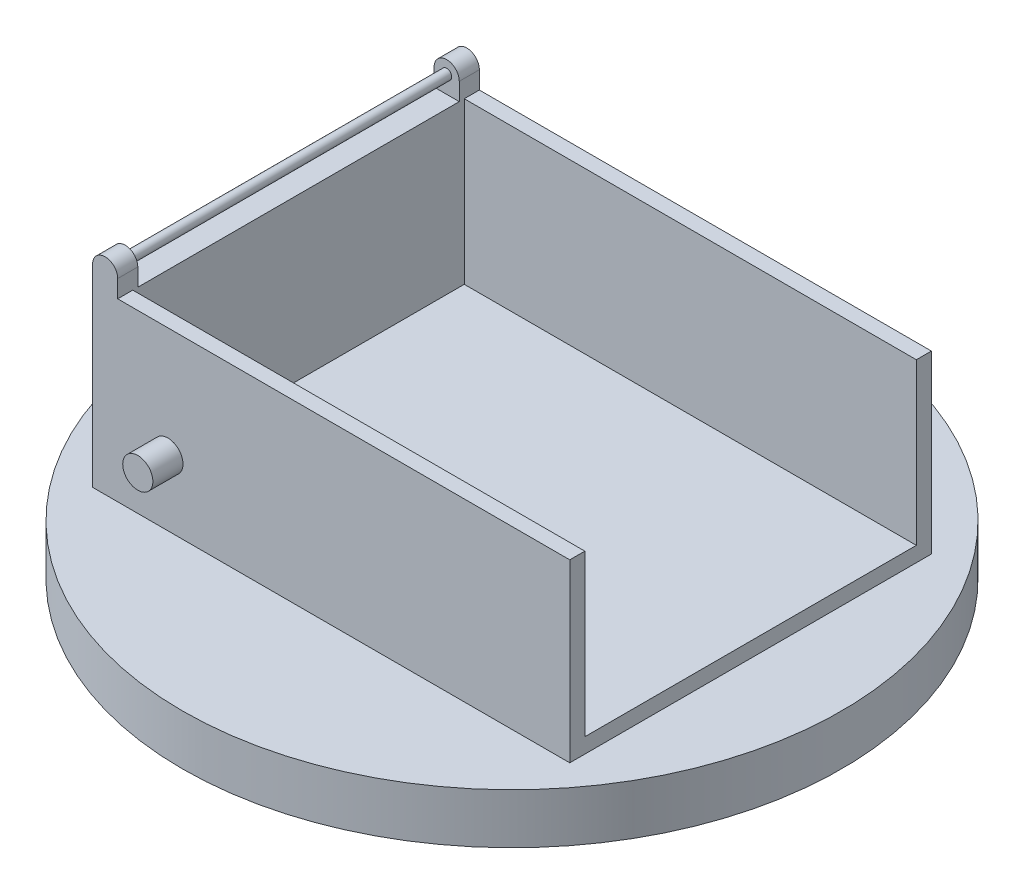
from build123d import *

# Parameters (mm, degrees)
SKETCH1_W           = 95
SKETCH1_H           = 72
BOSS_EXTRUDE1_DEPTH = 35
SKETCH5_W           = 90
SKETCH5_H           = 66
CUT_EXTRUDE1_DEPTH  = 32
SKETCH9_R           = 3
BOSS_EXTRUDE4_DEPTH = 6
BOSS_EXTRUDE5_DEPTH = 4
SKETCH11_R          = 65.611758171
BOSS_EXTRUDE6_DEPTH = 10
SKETCH12_R          = 17.640424805
SKETCH12_R_2        = 8.122416637
BOSS_EXTRUDE7_DEPTH = 30
SKETCH13_R          = 1
BOSS_EXTRUDE8_DEPTH = 68


with BuildPart() as part:
    # Sketch1 → Boss-Extrude1 (new body)
    with BuildSketch(Plane(origin=(0, 0, 0), x_dir=(1, 0, 0), z_dir=(0, 1, 0))):
        Rectangle(SKETCH1_W, SKETCH1_H)
    extrude(amount=BOSS_EXTRUDE1_DEPTH)

    # Sketch5 → Cut-Extrude1 (cut)
    with BuildSketch(Plane(origin=(0, 35, 0), x_dir=(1, 0, 0), z_dir=(0, 1, 0))):
        with Locations((2.5, 0)):
            Rectangle(SKETCH5_W, SKETCH5_H)
    extrude(amount=-CUT_EXTRUDE1_DEPTH, mode=Mode.SUBTRACT)

    # Sketch9 → Boss-Extrude4 (add)
    with BuildSketch(Plane.XY.offset(36)):
        with Locations(Location((-32.5, 13, 0), (0, 0, 180))):
            Circle(SKETCH9_R)
    boss_extrude4 = extrude(amount=BOSS_EXTRUDE4_DEPTH)

    # Mirror3: Boss-Extrude4 across plane
    add(boss_extrude4.mirror(Plane.XY))

    # Sketch10 → Boss-Extrude5 (add)
    with BuildSketch(Plane.XY.offset(36)):
        with BuildLine():
            Line((-42.5, 35), (-42.5, 38.5))
            ThreePointArc((-42.5, 38.5), (-45, 41), (-47.5, 38.5))
            Line((-47.5, 38.5), (-47.5, 35))
            Line((-47.5, 35), (-42.5, 35))
        make_face()
    boss_extrude5 = extrude(amount=-BOSS_EXTRUDE5_DEPTH)

    # Mirror4: Boss-Extrude5 across plane
    add(boss_extrude5.mirror(Plane.XY))

    # Sketch11 → Boss-Extrude6 (add)
    with BuildSketch(Plane.XZ):
        with Locations(Location((0, 0, 0), (0, 0, 270))):
            Circle(SKETCH11_R)
    extrude(amount=BOSS_EXTRUDE6_DEPTH)

    # Sketch12 → Boss-Extrude7 (add)
    with BuildSketch(Plane.XZ.offset(10)):
        with Locations(Location((0, 0, 0), (0, 0, 270))):
            Circle(SKETCH12_R)
        with Locations(Location((0, 0, 0), (0, 0, 270))):
            Circle(SKETCH12_R_2, mode=Mode.SUBTRACT)
    extrude(amount=BOSS_EXTRUDE7_DEPTH)

    # Sketch13 → Boss-Extrude8 (add)
    with BuildSketch(Plane.XY.offset(36)):
        with Locations((-45, 38.5)):
            Circle(SKETCH13_R)
    extrude(amount=-BOSS_EXTRUDE8_DEPTH)


solid = part.part
